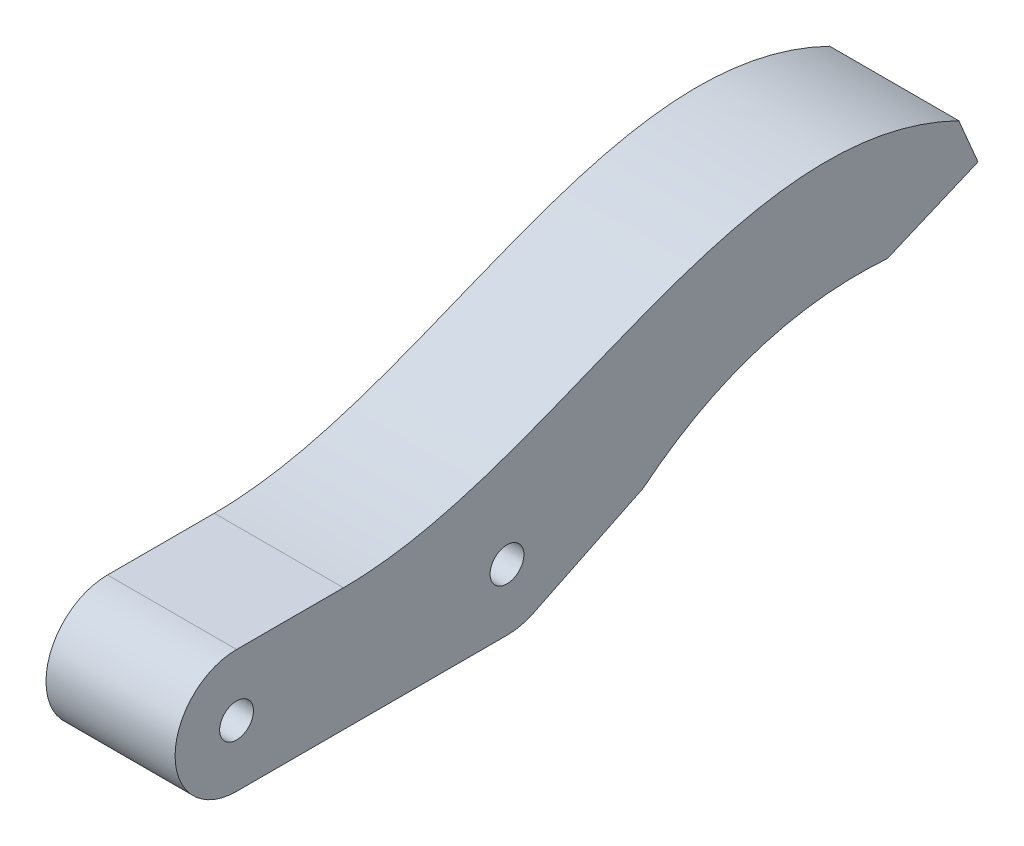
from build123d import *

# Parameters (mm, degrees)
BOSS_EXTRUDE1_DEPTH = 10.5
BOSS_EXTRUDE2_START = -10.5
BOSS_EXTRUDE2_DEPTH = 10.5
SKETCH3_R           = 1.375
CUT_EXTRUDE1_DEPTH  = 70.224771272


with BuildPart() as part:
    # Sketch1 → Boss-Extrude1 (new body)
    with BuildSketch(Plane(origin=(0, 0, 0), x_dir=(0, 0, -1), z_dir=(1, 0, 0))):
        with BuildLine():
            Line((27, 10), (5, 10))
            ThreePointArc((5, 10), (0, 5), (5, 0))
            Line((5, 0), (27, 0))
            ThreePointArc((27, 0), (32, 5), (27, 10))
        make_face()
    extrude(amount=BOSS_EXTRUDE1_DEPTH)

    # Sketch2 → Boss-Extrude2 (add)
    with BuildSketch(Plane(origin=(10.5, 0, 0), x_dir=(0, 0, -1), z_dir=(1, 0, 0)).offset(BOSS_EXTRUDE2_START)):
        with BuildLine():
            add(Edge.make_bspline(
                [(63.752972286, 17.872423117), (45.928882678, 26.563787963), (31.059268621, 10), (13.694974759, 10)],
                knots=[0, 0, 0, 0, 1, 1, 1, 1], degree=3))
            Line((13.694974759, 10), (27, 10))
            ThreePointArc((27, 10), (31.87285141, 6.120410255), (29.183837075, 0.502127655))
            Line((29.183837075, 0.502127655), (38.08542066, 4.824084077))
            add(Edge.make_bspline(
                [(38.08542066, 4.824084077), (46.797509509, 11.895222457), (57.948000409, 11.067843667)],
                knots=[0, 0, 0, 1, 1, 1], degree=2))
            Line((57.948000409, 11.067843667), (65.313809691, 14.189518476))
            Line((65.313809691, 14.189518476), (63.752972286, 17.872423117))
        make_face()
    extrude(amount=BOSS_EXTRUDE2_DEPTH)

    # Sketch3 → Cut-Extrude1 (cut, through all)
    with BuildSketch(Plane(origin=(10.5, 0, 0), x_dir=(0, 0, -1), z_dir=(1, 0, 0))):
        with Locations((5, 5)):
            Circle(SKETCH3_R)
        with Locations((27, 5)):
            Circle(SKETCH3_R)
    extrude(amount=-CUT_EXTRUDE1_DEPTH, mode=Mode.SUBTRACT)


solid = part.part
